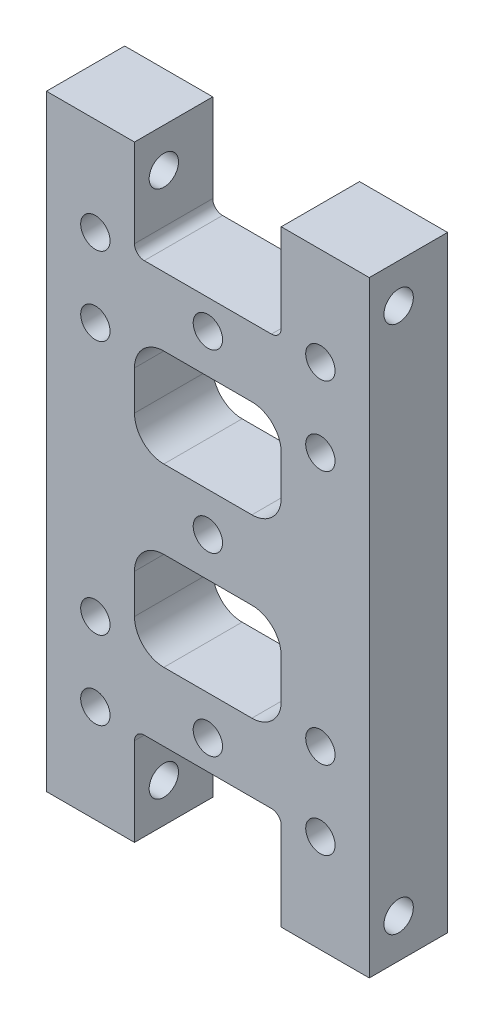
from build123d import *

# Parameters (mm, degrees)
SKETCH_1_W          = 33
SKETCH_1_H          = 62
EXTRUDE_1_DEPTH     = 8
SKETCH_2_W          = 15
SKETCH_2_H          = 10
CUT_EXTRUDE_1_DEPTH = 37.017356927
SKETCH_3_R          = 1.5
CUT_EXTRUDE_2_DEPTH = 37.017356927
SKETCH_4_R          = 1.5
CUT_EXTRUDE_3_DEPTH = 46.97825573
FILLET_2_R          = 1
SKETCH_5_R          = 1.5
CUT_EXTRUDE_4_DEPTH = 37.017356927
SKETCH_7_W          = 15
SKETCH_7_H          = 10
CUT_EXTRUDE_5_DEPTH = 37.017356927
FILLET_3_R          = 3
SKETCH_8_R          = 3.5
SKETCH_8_R_2        = 3
CUT_EXTRUDE_6_DEPTH = 3.5


with BuildPart() as part:
    # 草图1 → 凸台-拉伸1 (new body)
    with BuildSketch(Plane.XY):
        Rectangle(SKETCH_1_W, SKETCH_1_H)
    extrude(amount=EXTRUDE_1_DEPTH)

    # 草图2 → 切除-拉伸1 (cut, through all)
    with BuildSketch(Plane.XY.offset(8)):
        with Locations((0, 26)):
            Rectangle(SKETCH_2_W, SKETCH_2_H)
        with Locations((0, -26)):
            Rectangle(SKETCH_2_W, SKETCH_2_H)
    extrude(amount=-CUT_EXTRUDE_1_DEPTH, mode=Mode.SUBTRACT)

    # 草图3 → 切除-拉伸2 (cut, through all)
    with BuildSketch(Plane.XY.offset(8)):
        with Locations((11.5, 13)):
            Circle(SKETCH_3_R)
        with Locations((11.5, 21)):
            Circle(SKETCH_3_R)
        with Locations(Location((11.5, -21, 0), (0, 0, 180))):
            Circle(SKETCH_3_R)
        with Locations(Location((11.5, -13, 0), (0, 0, 180))):
            Circle(SKETCH_3_R)
        with Locations((-11.5, -13)):
            Circle(SKETCH_3_R)
        with Locations((-11.5, -21)):
            Circle(SKETCH_3_R)
        with Locations(Location((-11.5, 21, 0), (0, 0, 180))):
            Circle(SKETCH_3_R)
        with Locations(Location((-11.5, 13, 0), (0, 0, 180))):
            Circle(SKETCH_3_R)
    extrude(amount=-CUT_EXTRUDE_2_DEPTH, mode=Mode.SUBTRACT)

    # 草图4 → 切除-拉伸3 (cut, through all)
    with BuildSketch(Plane.ZY.offset(16.5)):
        with Locations((5, 27)):
            Circle(SKETCH_4_R)
        with Locations(Location((5, -27, 0), (0, 0, 180))):
            Circle(SKETCH_4_R)
    extrude(amount=-CUT_EXTRUDE_3_DEPTH, mode=Mode.SUBTRACT)

    # 圆角2
    fillet_2_edges = [part.edges().sort_by_distance(p)[0] for p in [
        (7.5, 21, 4),
        (-7.5, 21, 4),
        (-7.5, -21, 4),
        (7.5, -21, 4),
    ]]
    fillet(fillet_2_edges, radius=FILLET_2_R)

    # 草图5 → 切除-拉伸4 (cut, through all)
    with BuildSketch(Plane(origin=(0, 0, 0), x_dir=(-1, 0, 0), z_dir=(0, 0, -1))):
        Circle(SKETCH_5_R)
        with Locations((0, 18)):
            Circle(SKETCH_5_R)
        with Locations(Location((0, -18, 0), (0, 0, 180))):
            Circle(SKETCH_5_R)
    extrude(amount=-CUT_EXTRUDE_4_DEPTH, mode=Mode.SUBTRACT)

    # 草图7 → 切除-拉伸5 (cut, through all)
    with BuildSketch(Plane(origin=(0, 0, 0), x_dir=(-1, 0, 0), z_dir=(0, 0, -1))):
        with Locations((0, 9)):
            Rectangle(SKETCH_7_W, SKETCH_7_H)
        with Locations((0, -9)):
            Rectangle(SKETCH_7_W, SKETCH_7_H)
    extrude(amount=-CUT_EXTRUDE_5_DEPTH, mode=Mode.SUBTRACT)

    # 圆角3
    fillet_3_edges = [part.edges().sort_by_distance(p)[0] for p in [
        (-7.5, 14, 4),
        (-7.5, 4, 4),
        (7.5, 4, 4),
        (7.5, 14, 4),
        (7.5, -14, 4),
        (7.5, -4, 4),
        (-7.5, -4, 4),
        (-7.5, -14, 4),
    ]]
    fillet(fillet_3_edges, radius=FILLET_3_R)

    # 草图8 → 切除-拉伸6 (cut)
    with BuildSketch(Plane(origin=(0, 0, 0), x_dir=(-1, 0, 0), z_dir=(0, 0, -1))):
        with Locations((11.5, 21)):
            Circle(SKETCH_8_R)
        with Locations((-11.5, 21)):
            Circle(SKETCH_8_R)
        with Locations((-11.5, -21)):
            Circle(SKETCH_8_R)
        with Locations((11.5, -21)):
            Circle(SKETCH_8_R)
        Circle(SKETCH_8_R_2)
    extrude(amount=-CUT_EXTRUDE_6_DEPTH, mode=Mode.SUBTRACT)


solid = part.part
